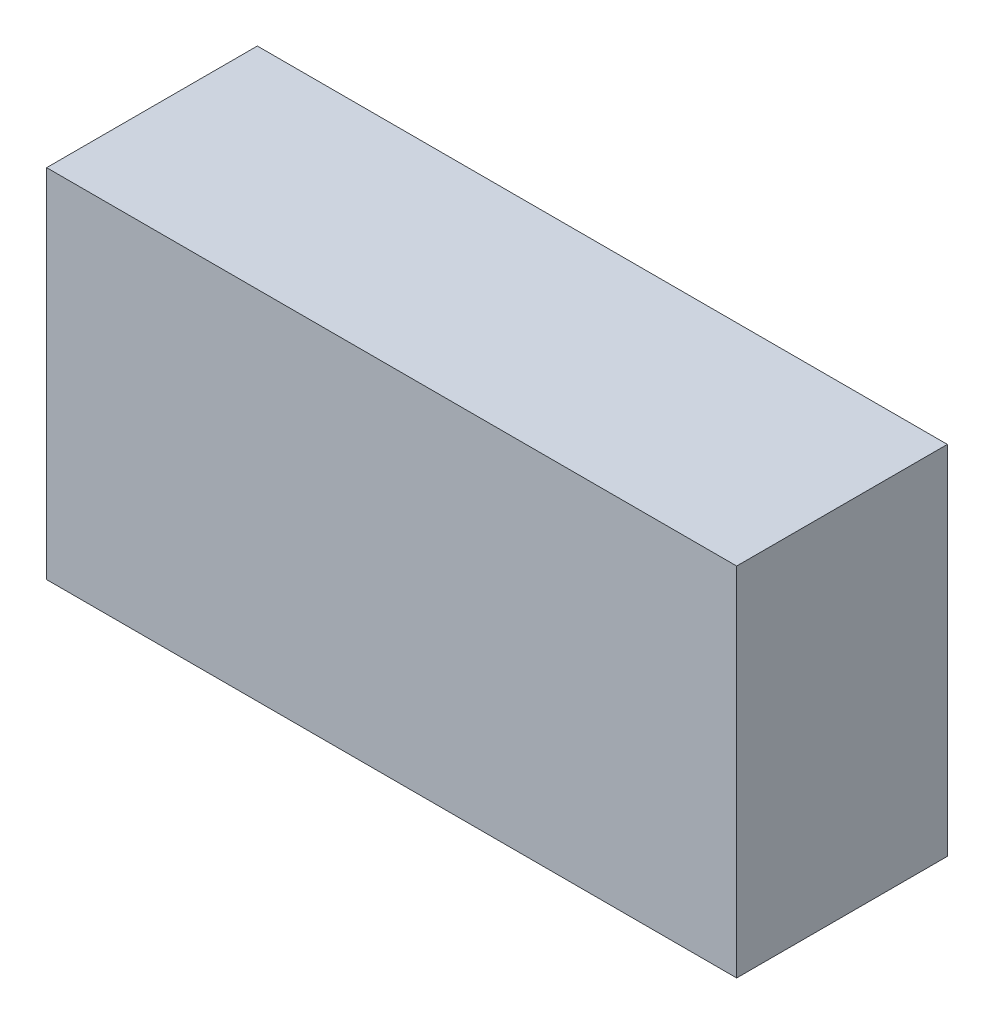
from build123d import *

# Parameters (mm, degrees)
SKETCH1_W           = 19.65
SKETCH1_H           = 6
BOSS_EXTRUDE1_DEPTH = 10.16
SKETCH2_R           = 0.25
BOSS_EXTRUDE2_DEPTH = 4.1


with BuildPart() as part:
    # Sketch1 → Boss-Extrude1 (new body)
    with BuildSketch(Plane(origin=(0, 0, 0), x_dir=(1, 0, 0), z_dir=(0, 1, 0))):
        Rectangle(SKETCH1_W, SKETCH1_H)
    extrude(amount=BOSS_EXTRUDE1_DEPTH)

    # Sketch2 → Boss-Extrude2 (add)
    with BuildSketch(Plane.XZ):
        with Locations(Location((0.005, -2.1, 0), (0, 0, 90))):
            Circle(SKETCH2_R)
        with Locations(Location((2.545, -2.1, 0), (0, 0, 90))):
            Circle(SKETCH2_R)
        with Locations(Location((5.085, -2.1, 0), (0, 0, 90))):
            Circle(SKETCH2_R)
        with Locations(Location((-5.075, -2.1, 0), (0, 0, 90))):
            Circle(SKETCH2_R)
        with Locations(Location((-7.615, -2.1, 0), (0, 0, 90))):
            Circle(SKETCH2_R)
    extrude(amount=BOSS_EXTRUDE2_DEPTH)


solid = part.part
